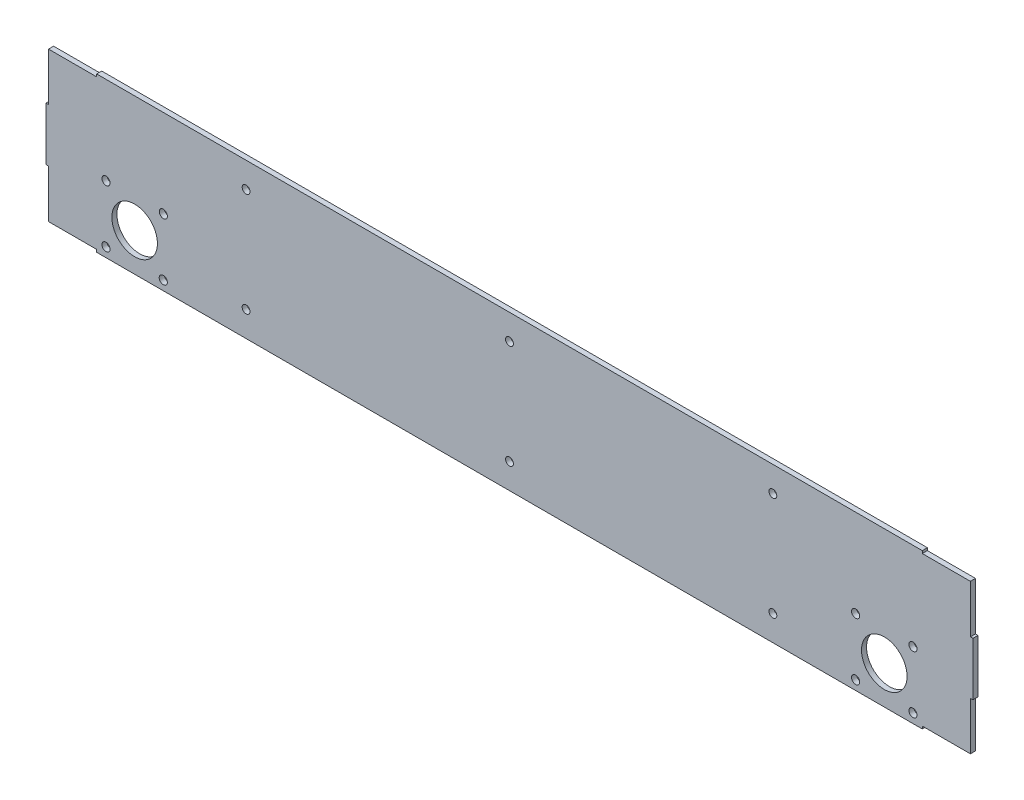
from build123d import *

# Parameters (mm, degrees)
BOSS_EXTRUDE1_DEPTH          = 3.175
F_10_0_1935_DIAMETER_HOLE2_D = 4.9149
SKETCH5_R                    = 2.5527
SKETCH5_R_2                  = 14.2875
CUT_EXTRUDE2_DEPTH           = 6.35


with BuildPart() as part:
    # Sketch2 → Boss-Extrude1 (new body)
    with BuildSketch(Plane.XY):
        Polygon((0, 63.5), (-1.5875, 63.5), (-1.5875, 30.1625), (0, 30.1625), (0, 0), (30.1625, 0), (30.1625, -1.5875), (547.6875, -1.5875), (547.6875, 0), (577.85, 0), (577.85, 30.1625), (579.4375, 30.1625), (579.4375, 63.5), (577.85, 63.5), (577.85, 93.6625), (547.6875, 93.6625), (547.6875, 95.25), (30.1625, 95.25), (30.1625, 93.6625), (0, 93.6625), align=None)
    extrude(amount=BOSS_EXTRUDE1_DEPTH)

    # #10 (0.1935) Diameter Hole2 (through all)
    with Locations(Plane.XY.offset(3.175)):
        with Locations((288.925, 79.375), (123.825, 79.375), (454.025, 79.375), (454.025, 14.2875), (123.825, 14.2875), (288.925, 14.2875)):
            Hole(F_10_0_1935_DIAMETER_HOLE2_D / 2)

    # Sketch5 → Cut-Extrude2 (cut)
    with BuildSketch(Plane(origin=(0, 0, 0), x_dir=(-1, 0, 0), z_dir=(0, 0, -1))):
        with Locations((-541.825524484, 40.195494446)):
            Circle(SKETCH5_R)
        with Locations((-505.92448107, 4.2545)):
            Circle(SKETCH5_R)
        with Locations((-523.875002777, 22.224997223)):
            Circle(SKETCH5_R_2)
        with Locations((-541.8455, 4.274475516)):
            Circle(SKETCH5_R)
        with Locations((-505.904505554, 40.17551893)):
            Circle(SKETCH5_R)
        with Locations((-71.945494446, 40.17551893)):
            Circle(SKETCH5_R)
        with Locations((-36.0045, 4.274475516)):
            Circle(SKETCH5_R)
        with Locations((-53.974997223, 22.224997223)):
            Circle(SKETCH5_R_2)
        with Locations((-71.92551893, 4.2545)):
            Circle(SKETCH5_R)
        with Locations((-36.024475516, 40.195494446)):
            Circle(SKETCH5_R)
    extrude(amount=-CUT_EXTRUDE2_DEPTH, mode=Mode.SUBTRACT)


solid = part.part
